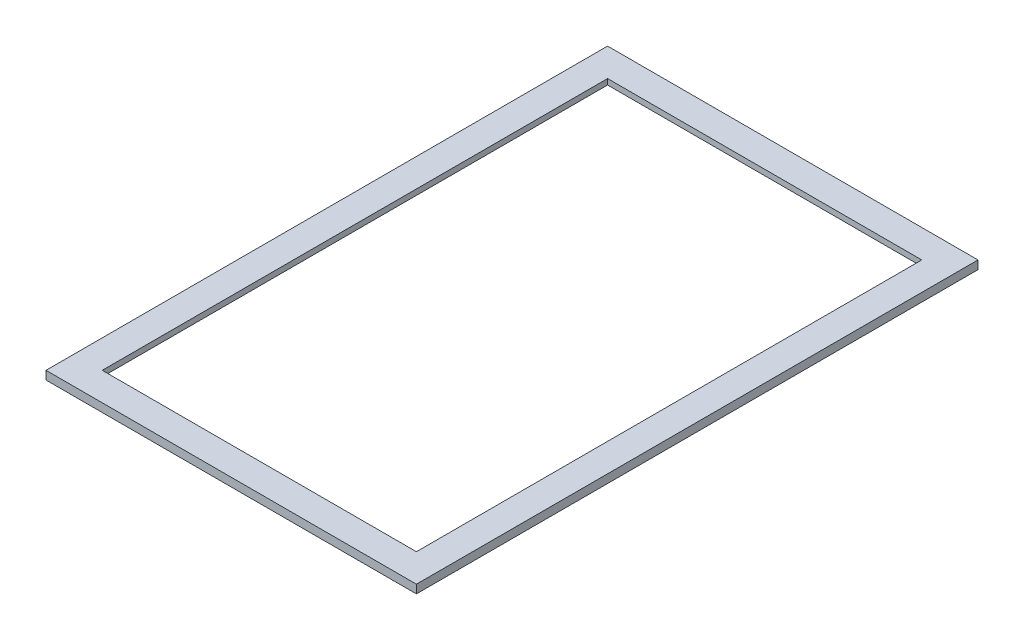
from build123d import *

# Parameters (mm, degrees)
SKETCH_1_W          = 131.75
SKETCH_1_H          = 199.75
EXTRUDE_1_DEPTH     = 3
SKETCH_2_W          = 111.75
SKETCH_2_H          = 179.75
CUT_EXTRUDE_1_DEPTH = 6
SKETCH_3_W          = 121.75
SKETCH_3_H          = 189.75
CUT_EXTRUDE_2_DEPTH = 1


with BuildPart() as part:
    # Эскиз1 → Бобышка-Вытянуть1 (new body)
    with BuildSketch(Plane(origin=(0, 0, 0), x_dir=(1, 0, 0), z_dir=(0, 1, 0))):
        Rectangle(SKETCH_1_W, SKETCH_1_H)
    extrude(amount=EXTRUDE_1_DEPTH)

    # Эскиз2 → Вырез-Вытянуть1 (cut)
    with BuildSketch(Plane(origin=(0, 3, 0), x_dir=(1, 0, 0), z_dir=(0, 1, 0))):
        Rectangle(SKETCH_2_W, SKETCH_2_H)
    extrude(amount=-CUT_EXTRUDE_1_DEPTH, mode=Mode.SUBTRACT)

    # Эскиз3 → Вырез-Вытянуть2 (cut)
    with BuildSketch(Plane.XZ):
        Rectangle(SKETCH_3_W, SKETCH_3_H)
    extrude(amount=-CUT_EXTRUDE_2_DEPTH, mode=Mode.SUBTRACT)


solid = part.part
